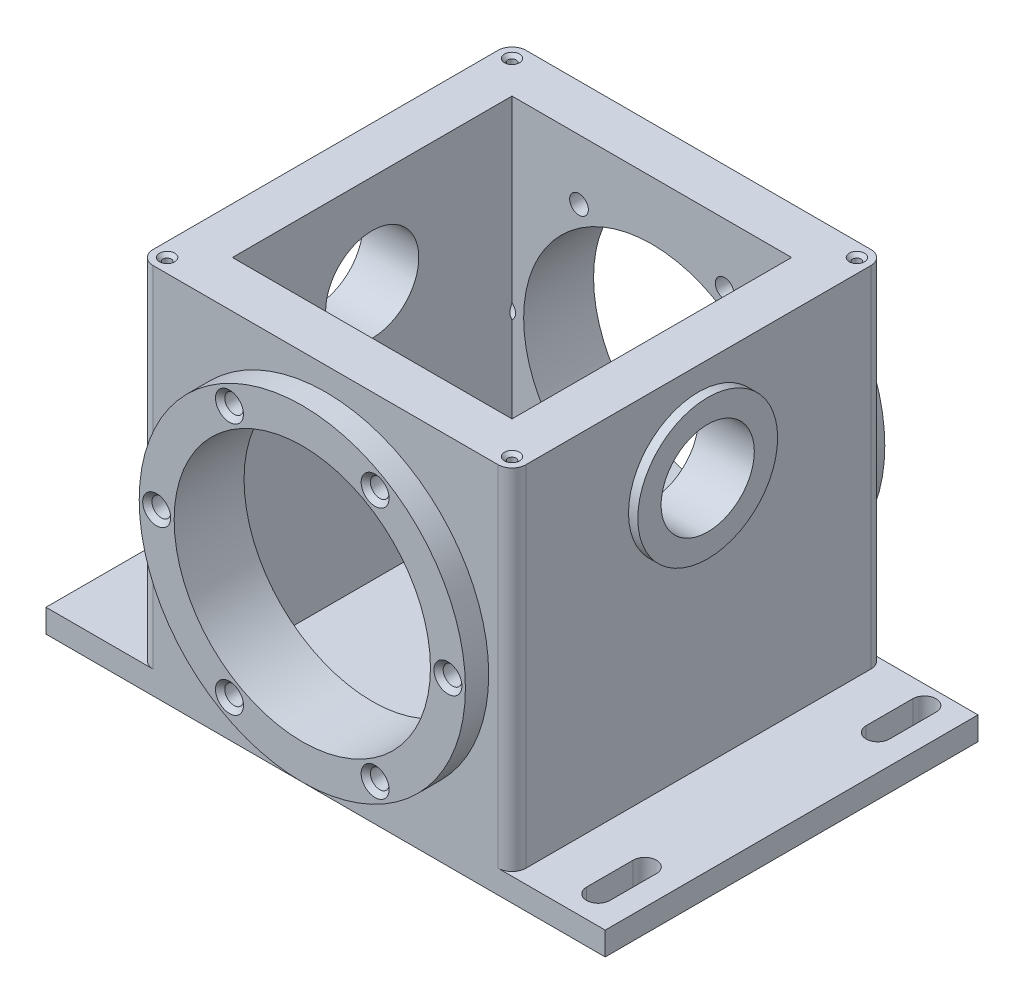
from build123d import *

# Parameters (mm, degrees)
SKETCH4_W                       = 152.4
SKETCH4_H                       = 101.6
BOSS_EXTRUDE3_DEPTH             = 6.35
SKETCH5_W                       = 101.6
SKETCH5_H                       = 101.6
BOSS_EXTRUDE4_DEPTH             = 95.25
SKETCH6_W                       = 76.2
SKETCH6_H                       = 76.2
CUT_EXTRUDE1_DEPTH              = 95.25
SKETCH7_R                       = 44.45
BOSS_EXTRUDE5_DEPTH             = 6.35
SKETCH8_R                       = 34.925
CUT_EXTRUDE3_DEPTH              = 171.861025398
CIRPATTERN1_COUNT               = 6
FILLET1_R                       = 3.81
F_4_40_TAPPED_HOLE1_D           = 2.2606
F_4_40_TAPPED_HOLE1_DEPTH       = 8.8646
F_4_40_TAPPED_HOLE1_CSINK_D     = 4.1148
F_4_40_TAPPED_HOLE1_CSINK_ANGLE = 90
F_4_40_TAPPED_HOLE1_TIP         = 0.679152758
SKETCH16_R                      = 19.05
BOSS_EXTRUDE6_DEPTH             = 2.54
CUT_EXTRUDE4_DEPTH              = 175.267880288
CUT_EXTRUDE4_DEPTH_BACK         = 175.267880288
SKETCH17_R                      = 12.7
CUT_EXTRUDE5_DEPTH              = 135.703841816
LPATTERN1_COUNT                 = 2
LPATTERN1_PITCH                 = 76.2


with BuildPart() as part:
    # Sketch4 → Boss-Extrude3 (new body)
    with BuildSketch(Plane(origin=(0, 0, 0), x_dir=(1, 0, 0), z_dir=(0, 1, 0))):
        Rectangle(SKETCH4_W, SKETCH4_H)
    extrude(amount=BOSS_EXTRUDE3_DEPTH)

    # Sketch5 → Boss-Extrude4 (add)
    with BuildSketch(Plane(origin=(0, 6.35, 0), x_dir=(1, 0, 0), z_dir=(0, 1, 0))):
        Rectangle(SKETCH5_W, SKETCH5_H)
    extrude(amount=BOSS_EXTRUDE4_DEPTH)

    # Sketch6 → Cut-Extrude1 (cut)
    with BuildSketch(Plane(origin=(0, 101.6, 0), x_dir=(1, 0, 0), z_dir=(0, 1, 0))):
        Rectangle(SKETCH6_W, SKETCH6_H)
    extrude(amount=-CUT_EXTRUDE1_DEPTH, mode=Mode.SUBTRACT)

    # Sketch7 → Boss-Extrude5 (add)
    with BuildSketch(Plane.XY.offset(50.8)):
        with Locations((0, 50.8)):
            Circle(SKETCH7_R)
    boss_extrude5 = extrude(amount=BOSS_EXTRUDE5_DEPTH)

    # Mirror2: Boss-Extrude5 across plane
    add(boss_extrude5.mirror(Plane.XY))

    # Sketch8 → Cut-Extrude3 (cut, through all)
    with BuildSketch(Plane.XY.offset(57.15)):
        with Locations((0, 50.8)):
            Circle(SKETCH8_R)
    extrude(amount=-CUT_EXTRUDE3_DEPTH, mode=Mode.SUBTRACT)

    # Sketch13 → 1/4-20 Tapped Hole2 (revolve, cut)
    with BuildSketch(Plane(origin=(39.6875, 50.8, 57.15), x_dir=(0, -1, 0), z_dir=(1, 0, 0))):
        Polygon((0, 0), (0, 20.583816902), (2.5527, 19.05), (2.5527, 1.2573), (3.81, 0), align=None)
    f_1_4_20_tapped_hole2 = revolve(axis=Axis((39.6875, 50.8, 63.5), (0, 0, -1)), mode=Mode.SUBTRACT)

    # CirPattern1: 1/4-20 Tapped Hole2 ×6 about axis
    cirpattern1_axis = Axis((0, 50.8, 0), (0, 0, 1))
    for i in range(1, CIRPATTERN1_COUNT):
        add(f_1_4_20_tapped_hole2.rotate(cirpattern1_axis, i * 360 / CIRPATTERN1_COUNT), mode=Mode.SUBTRACT)

    # Fillet1
    fillet1_edges = [part.edges().sort_by_distance(p)[0] for p in [
        (50.8, 53.975, 50.8),
        (50.8, 53.975, -50.8),
        (-50.8, 53.975, -50.8),
        (-50.8, 53.975, 50.8),
    ]]
    fillet(fillet1_edges, radius=FILLET1_R)

    # #4-40 Tapped Hole1
    with Locations(Plane(origin=(0, 101.6, 0), x_dir=(1, 0, 0), z_dir=(0, 1, 0))):
        with Locations((-46.99, 46.99), (46.99, 46.99), (46.99, -46.99), (-46.99, -46.99)):
            CounterSinkHole(F_4_40_TAPPED_HOLE1_D / 2, F_4_40_TAPPED_HOLE1_CSINK_D / 2, depth=F_4_40_TAPPED_HOLE1_DEPTH, counter_sink_angle=F_4_40_TAPPED_HOLE1_CSINK_ANGLE)
            with Locations((0, 0, -(F_4_40_TAPPED_HOLE1_DEPTH + F_4_40_TAPPED_HOLE1_TIP / 2))):  # 118° drill point
                Cone(0, F_4_40_TAPPED_HOLE1_D / 2, F_4_40_TAPPED_HOLE1_TIP, mode=Mode.SUBTRACT)

    # Sketch16 → Boss-Extrude6 (add)
    with BuildSketch(Plane(origin=(50.8, 0, 0), x_dir=(0, 0, -1), z_dir=(1, 0, 0))):
        with Locations(Location((0, 76.2, 0), (0, 0, 180))):
            Circle(SKETCH16_R)
    boss_extrude6 = extrude(amount=BOSS_EXTRUDE6_DEPTH)

    # Mirror4: Boss-Extrude6 across plane
    add(boss_extrude6.mirror(Plane(origin=(0, 0, 0), x_dir=(0, 0, 1), z_dir=(1, 0, 0))))

    # Sketch17 → Cut-Extrude4 (cut, two sides: drawn at the far end of the back side and taken through both)
    with BuildSketch(Plane(origin=(53.34, 0, 0), x_dir=(0, 0, -1), z_dir=(1, 0, 0)).offset(-CUT_EXTRUDE4_DEPTH_BACK)):
        with Locations(Location((0, 76.2, 0), (0, 0, 180))):
            Circle(SKETCH17_R)
    extrude(amount=CUT_EXTRUDE4_DEPTH + CUT_EXTRUDE4_DEPTH_BACK, mode=Mode.SUBTRACT)

    # Mirror5: 1/4-20 Tapped Hole2 across plane
    add(f_1_4_20_tapped_hole2.mirror(Plane.XY), mode=Mode.SUBTRACT)

    # Mirror5 copy 1 sketch → Mirror5 copy 1 (revolve, cut)
    with BuildSketch(Plane(origin=(19.84375, 85.170383213, -57.15), x_dir=(0.8660254037844386, -0.5000000000000001, 0), z_dir=(0.5000000000000001, 0.8660254037844386, 0))):
        Polygon((0, 0), (0, -20.583816902), (2.5527, -19.05), (2.5527, -1.2573), (3.81, 0), align=None)
    revolve(axis=Axis((19.84375, 85.170383213, -63.5), (0, 0, -1)), mode=Mode.SUBTRACT)

    # Mirror5 copy 2 sketch → Mirror5 copy 2 (revolve, cut)
    with BuildSketch(Plane(origin=(-19.84375, 85.170383213, -57.15), x_dir=(0.8660254037844387, 0.4999999999999998, 0), z_dir=(-0.4999999999999998, 0.8660254037844387, 0))):
        Polygon((0, 0), (0, -20.583816902), (2.5527, -19.05), (2.5527, -1.2573), (3.81, 0), align=None)
    revolve(axis=Axis((-19.84375, 85.170383213, -63.5), (0, 0, -1)), mode=Mode.SUBTRACT)

    # Mirror5 copy 3 sketch → Mirror5 copy 3 (revolve, cut)
    with BuildSketch(Plane(origin=(-39.6875, 50.8, -57.15), x_dir=(0, 1, 0), z_dir=(-1, 0, 0))):
        Polygon((0, 0), (0, -20.583816902), (2.5527, -19.05), (2.5527, -1.2573), (3.81, 0), align=None)
    revolve(axis=Axis((-39.6875, 50.8, -63.5), (0, 0, -1)), mode=Mode.SUBTRACT)

    # Mirror5 copy 4 sketch → Mirror5 copy 4 (revolve, cut)
    with BuildSketch(Plane(origin=(-19.84375, 16.429616787, -57.15), x_dir=(-0.8660254037844384, 0.5000000000000004, 0), z_dir=(-0.5000000000000004, -0.8660254037844384, 0))):
        Polygon((0, 0), (0, -20.583816902), (2.5527, -19.05), (2.5527, -1.2573), (3.81, 0), align=None)
    revolve(axis=Axis((-19.84375, 16.429616787, -63.5), (0, 0, -1)), mode=Mode.SUBTRACT)

    # Mirror5 copy 5 sketch → Mirror5 copy 5 (revolve, cut)
    with BuildSketch(Plane(origin=(19.84375, 16.429616787, -57.15), x_dir=(-0.8660254037844386, -0.5000000000000001, 0), z_dir=(0.5000000000000001, -0.8660254037844386, 0))):
        Polygon((0, 0), (0, -20.583816902), (2.5527, -19.05), (2.5527, -1.2573), (3.81, 0), align=None)
    revolve(axis=Axis((19.84375, 16.429616787, -63.5), (0, 0, -1)), mode=Mode.SUBTRACT)

    # Sketch19 → Cut-Extrude5 (cut, through all)
    with BuildSketch(Plane(origin=(0, 6.35, 0), x_dir=(1, 0, 0), z_dir=(0, 1, 0))):
        with BuildLine():
            Line((69.85, -30.48), (69.85, -43.18))
            ThreePointArc((69.85, -43.18), (66.675, -46.355), (63.5, -43.18))
            Line((63.5, -43.18), (63.5, -30.48))
            ThreePointArc((63.5, -30.48), (66.675, -27.305), (69.85, -30.48))
        make_face()
    cut_extrude5 = extrude(amount=-CUT_EXTRUDE5_DEPTH, mode=Mode.SUBTRACT)

    # LPattern1: Cut-Extrude5 ×2
    with Locations(*[(0, 0, -i * LPATTERN1_PITCH) for i in range(1, LPATTERN1_COUNT)]):
        add(cut_extrude5, mode=Mode.SUBTRACT)


solid = part.part
